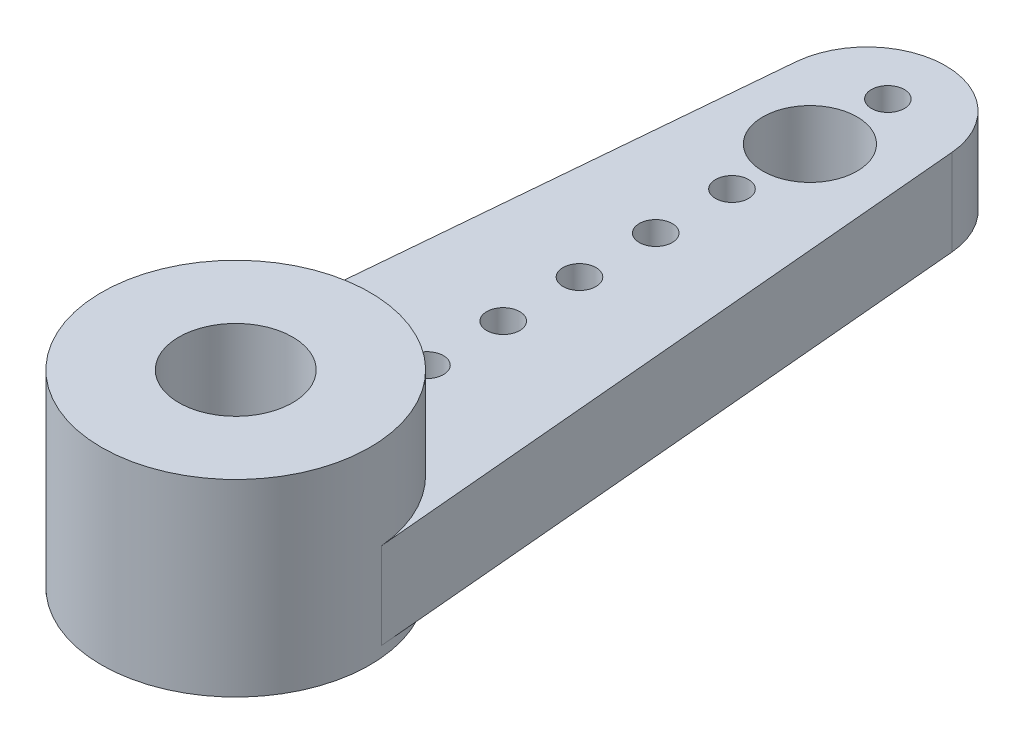
from build123d import *

# Parameters (mm, degrees)
BOSS_EXTRUDE1_DEPTH    = 2.2
SKETCH2_R              = 3.42
BOSS_EXTRUDE2_DEPTH    = 2.33
SKETCH6_R              = 0.42
SKETCH6_R_2            = 0.7
CUT_EXTRUDE5_DEPTH     = 19.547552399
BOSS_EXTRUDE3_START    = 0.27
SKETCH9_R              = 3.42
BOSS_EXTRUDE3_DEPTH    = 0.27
SKETCH10_R             = 2.29
CUT_EXTRUDE12_DEPTH    = 0.85
M2_5_CLEARANCE_HOLE2_D = 2.9
M2_CLEARANCE_HOLE1_D   = 2.4


with BuildPart() as part:
    # Sketch1 → Boss-Extrude1 (new body)
    with BuildSketch(Plane(origin=(0, 0, 0), x_dir=(1, 0, 0), z_dir=(0, 1, 0))):
        with BuildLine():
            Line((-3.406638664, 0.302014925), (-1.992186353, 16.256616915))
            ThreePointArc((-1.992186353, 16.256616915), (0, 18.08), (1.992186353, 16.256616915))
            Line((1.992186353, 16.256616915), (3.406638664, 0.302014925))
            ThreePointArc((3.406638664, 0.302014925), (0, -3.42), (-3.406638664, 0.302014925))
        make_face()
    extrude(amount=BOSS_EXTRUDE1_DEPTH)

    # Sketch2 → Boss-Extrude2 (add)
    with BuildSketch(Plane(origin=(0, 2.2, 0), x_dir=(1, 0, 0), z_dir=(0, 1, 0))):
        with Locations(Location((0, 0, 0), (0, 0, 5.066301357))):
            Circle(SKETCH2_R)
    extrude(amount=BOSS_EXTRUDE2_DEPTH)

    # Sketch6 → Cut-Extrude5 (cut, through all)
    with BuildSketch(Plane(origin=(0, 2.2, 0), x_dir=(1, 0, 0), z_dir=(0, 1, 0))):
        with Locations(Location((0, 4.87, 0), (0, 0, 270))):
            Circle(SKETCH6_R)
        with Locations(Location((0, 6.8125, 0), (0, 0, 270))):
            Circle(SKETCH6_R)
        with Locations(Location((0, 8.755, 0), (0, 0, 270))):
            Circle(SKETCH6_R)
        with Locations(Location((0, 10.6975, 0), (0, 0, 270))):
            Circle(SKETCH6_R)
        with Locations(Location((0, 12.64, 0), (0, 0, 270))):
            Circle(SKETCH6_R)
        with Locations(Location((0, 14.625, 0), (0, 0, 270))):
            Circle(SKETCH6_R_2)
        with Locations(Location((0, 16.61, 0), (0, 0, 270))):
            Circle(SKETCH6_R)
    extrude(amount=-CUT_EXTRUDE5_DEPTH, mode=Mode.SUBTRACT)

    # Sketch9 → Boss-Extrude3 (add)
    with BuildSketch(Plane.XZ.offset(BOSS_EXTRUDE3_START)):
        with Locations(Location((0, 0, 0), (0, 0, 90))):
            Circle(SKETCH9_R)
    extrude(amount=-BOSS_EXTRUDE3_DEPTH)

    # Sketch10 → Cut-Extrude12 (cut)
    with BuildSketch(Plane.XZ.offset(0.27)):
        with Locations(Location((0, 0, 0), (0, 0, 270))):
            Circle(SKETCH10_R)
    extrude(amount=-CUT_EXTRUDE12_DEPTH, mode=Mode.SUBTRACT)

    # M2.5 Clearance Hole2 (through all)
    with Locations(Plane(origin=(0, 0.58, 0), x_dir=(-1, 0, 0), z_dir=(0, -1, 0))):
        with Locations((0, 0)):
            Hole(M2_5_CLEARANCE_HOLE2_D / 2)

    # M2 Clearance Hole1 (through all)
    with Locations(Plane(origin=(0, 0, 0), x_dir=(-1, 0, 0), z_dir=(0, -1, 0))):
        with Locations((0, 14.625)):
            Hole(M2_CLEARANCE_HOLE1_D / 2)


solid = part.part
